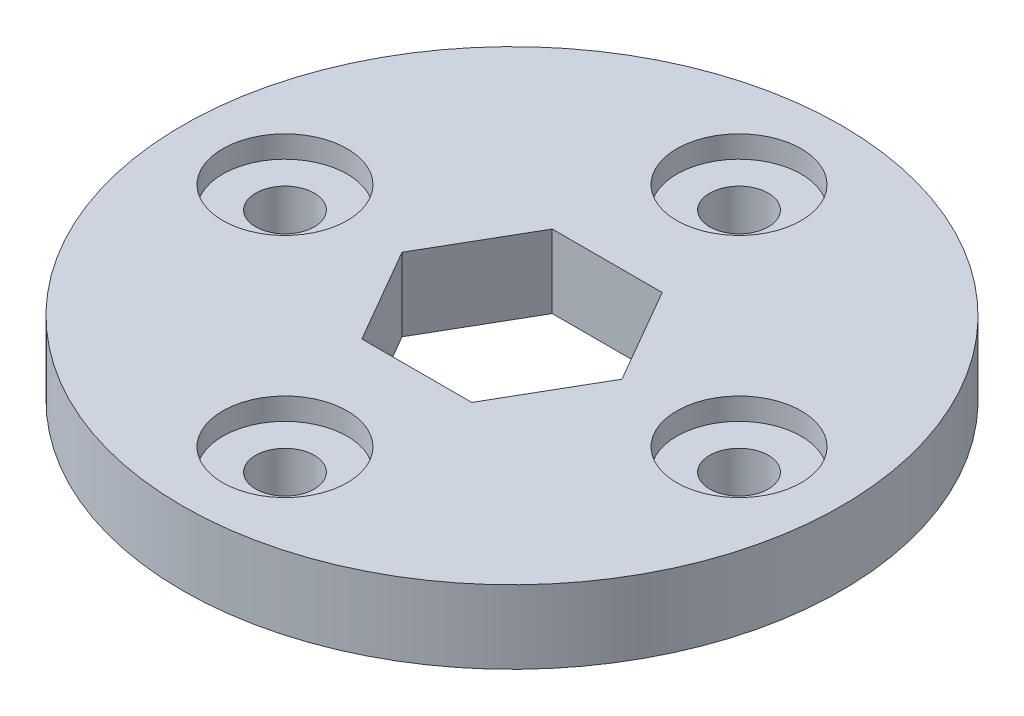
from build123d import *

# Parameters (mm, degrees)
SKETCH1_R           = 22.5
SKETCH1_R_2         = 2
BOSS_EXTRUDE1_DEPTH = 5
SKETCH2_R           = 4.25
CUT_EXTRUDE1_DEPTH  = 1.5


with BuildPart() as part:
    # Sketch1 → Boss-Extrude1 (new body)
    with BuildSketch(Plane(origin=(0, 0, 0), x_dir=(1, 0, 0), z_dir=(0, 1, 0))):
        with Locations(Location((0, 0, 0), (0, 0, 270))):
            Circle(SKETCH1_R)
        with Locations(Location((0, 15.5, 0), (0, 0, 270))):
            Circle(SKETCH1_R_2, mode=Mode.SUBTRACT)
        with Locations(Location((15.5, 0, 0), (0, 0, 270))):
            Circle(SKETCH1_R_2, mode=Mode.SUBTRACT)
        with Locations(Location((0, -15.5, 0), (0, 0, 270))):
            Circle(SKETCH1_R_2, mode=Mode.SUBTRACT)
        with Locations(Location((-15.5, 0, 0), (0, 0, 270))):
            Circle(SKETCH1_R_2, mode=Mode.SUBTRACT)
        Polygon((7.505553499, 0), (3.75277675, 6.5), (-3.75277675, 6.5), (-7.505553499, 0), (-3.75277675, -6.5), (3.75277675, -6.5), align=None, mode=Mode.SUBTRACT)
    extrude(amount=BOSS_EXTRUDE1_DEPTH)

    # Sketch2 → Cut-Extrude1 (cut)
    with BuildSketch(Plane(origin=(0, 5, 0), x_dir=(1, 0, 0), z_dir=(0, 1, 0))):
        with Locations(Location((0, 15.5, 0), (0, 0, 270))):
            Circle(SKETCH2_R)
        with Locations(Location((15.5, 0, 0), (0, 0, 270))):
            Circle(SKETCH2_R)
        with Locations(Location((0, -15.5, 0), (0, 0, 270))):
            Circle(SKETCH2_R)
        with Locations(Location((-15.5, 0, 0), (0, 0, 270))):
            Circle(SKETCH2_R)
    extrude(amount=-CUT_EXTRUDE1_DEPTH, mode=Mode.SUBTRACT)


solid = part.part
